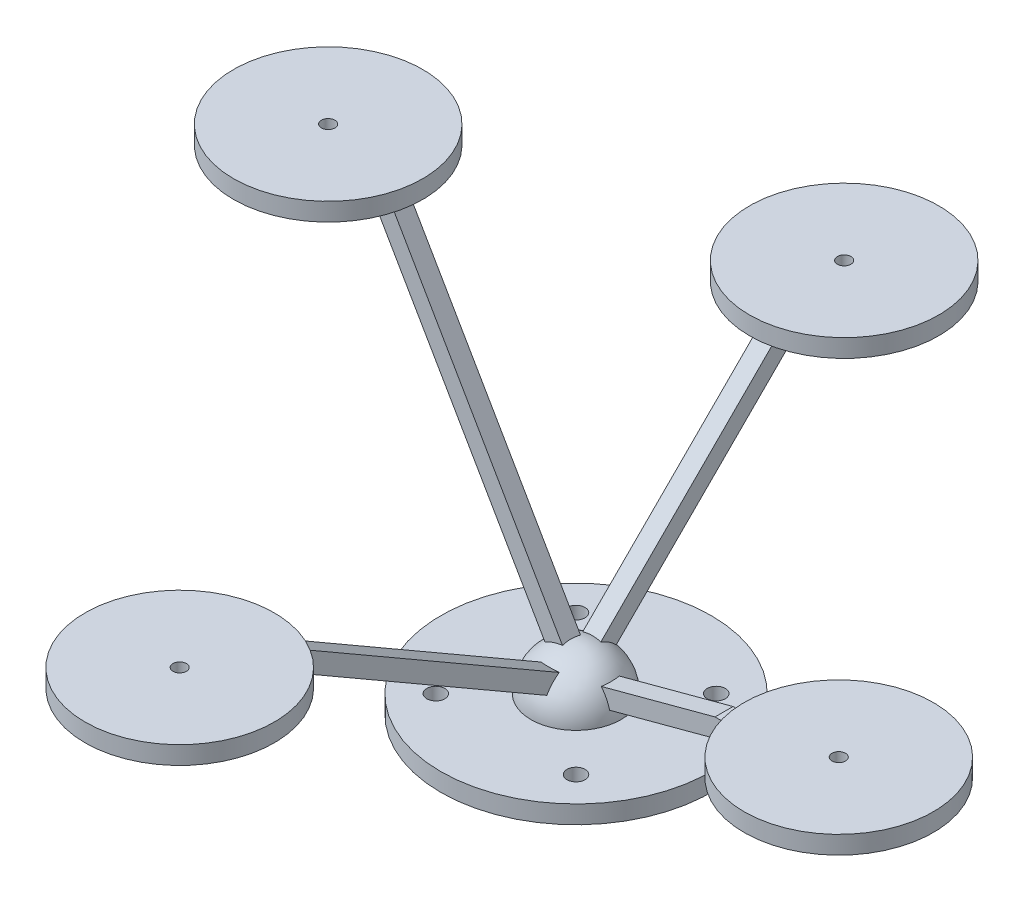
from build123d import *

# Parameters (mm, degrees)
SKETCH_1_R      = 15
SKETCH_1_R_2    = 1
EXTRUDE_1_DEPTH = 2
EXTRUDE_2_DEPTH = 1
SKETCH_4_R      = 10.5
SKETCH_4_R_2    = 0.75
EXTRUDE_3_DEPTH = 2
SKETCH_5_R      = 10.5
SKETCH_5_R_2    = 0.75
EXTRUDE_4_DEPTH = 2
EXTRUDE_5_DEPTH = 1
SKETCH_7_R      = 10.5
SKETCH_7_R_2    = 0.75
EXTRUDE_6_DEPTH = 2
SKETCH_8_R      = 10.5
SKETCH_8_R_2    = 0.75
EXTRUDE_7_DEPTH = 2


with BuildPart() as part:
    # 草图1 → 凸台-拉伸1 (new body)
    with BuildSketch(Plane(origin=(0, 0, 0), x_dir=(1, 0, 0), z_dir=(0, 1, 0))):
        with Locations(Location((0, 0, 0), (0, 0, 270))):
            Circle(SKETCH_1_R)
        with Locations(Location((7.778174593, 7.778174593, 0), (0, 0, 270))):
            Circle(SKETCH_1_R_2, mode=Mode.SUBTRACT)
        with Locations(Location((-7.778174593, 7.778174593, 0), (0, 0, 270))):
            Circle(SKETCH_1_R_2, mode=Mode.SUBTRACT)
        with Locations(Location((-7.778174593, -7.778174593, 0), (0, 0, 270))):
            Circle(SKETCH_1_R_2, mode=Mode.SUBTRACT)
        with Locations(Location((7.778174593, -7.778174593, 0), (0, 0, 270))):
            Circle(SKETCH_1_R_2, mode=Mode.SUBTRACT)
    extrude(amount=EXTRUDE_1_DEPTH)

    # 草图2 → 旋转1 (revolve)
    with BuildSketch(Plane(origin=(0, 0, 0), x_dir=(0, 0, -1), z_dir=(1, 0, 0))):
        with BuildLine():
            Line((0, 2), (0, 7))
            ThreePointArc((0, 7), (3.535533906, 5.535533906), (5, 2))
            Line((5, 2), (0, 2))
        make_face()
    revolve(axis=Axis((0, 2, 0), (0, 1, 0)))

    # 草图3 → 凸台-拉伸2 (add, symmetric)
    with BuildSketch(Plane.XY):
        Polygon((0, 2), (24.148145657, 8.470476128), (16.420739047, 8.470476128), (0, 4.070552361), (0, 6), (-20.190598923, 40.97114317), (-22.5, 40.97114317), align=None)
    extrude(amount=EXTRUDE_2_DEPTH, both=True)

    # 草图4 → 凸台-拉伸3 (add)
    with BuildSketch(Plane(origin=(0, 8.470476128, 0), x_dir=(1, 0, 0), z_dir=(0, 1, 0))):
        with Locations(Location((29.148145657, 0, 0), (0, 0, 174.5349762))):
            Circle(SKETCH_4_R)
        with Locations(Location((29.148145657, 0, 0), (0, 0, 270))):
            Circle(SKETCH_4_R_2, mode=Mode.SUBTRACT)
    extrude(amount=EXTRUDE_3_DEPTH)

    # 草图5 → 凸台-拉伸4 (add)
    with BuildSketch(Plane(origin=(0, 40.97114317, 0), x_dir=(1, 0, 0), z_dir=(0, 1, 0))):
        with Locations(Location((-27.5, 0, 0), (0, 0, 270))):
            Circle(SKETCH_5_R)
        with Locations(Location((-27.5, 0, 0), (0, 0, 270))):
            Circle(SKETCH_5_R_2, mode=Mode.SUBTRACT)
    extrude(amount=EXTRUDE_4_DEPTH)

    # 草图6 → 凸台-拉伸5 (add, symmetric)
    with BuildSketch(Plane(origin=(0, 0, 0), x_dir=(0, 0, -1), z_dir=(1, 0, 0))):
        Polygon((0, 2), (24.748737342, 26.748737342), (21.920310217, 26.748737342), (0, 4.828427125), (0, 4.309401077), (-34.97114317, 24.5), (-38.97114317, 24.5), align=None)
    extrude(amount=EXTRUDE_5_DEPTH, both=True)

    # 草图7 → 凸台-拉伸6 (add)
    with BuildSketch(Plane(origin=(0, 26.748737342, 0), x_dir=(1, 0, 0), z_dir=(0, 1, 0))):
        with Locations(Location((0, 29.748737342, 0), (0, 0, 270))):
            Circle(SKETCH_7_R)
        with Locations(Location((0, 29.748737342, 0), (0, 0, 270))):
            Circle(SKETCH_7_R_2, mode=Mode.SUBTRACT)
    extrude(amount=EXTRUDE_6_DEPTH)

    # 草图8 → 凸台-拉伸7 (add)
    with BuildSketch(Plane(origin=(0, 24.5, 0), x_dir=(1, 0, 0), z_dir=(0, 1, 0))):
        with Locations(Location((0, -43.97114317, 0), (0, 0, 270))):
            Circle(SKETCH_8_R)
        with Locations(Location((0, -43.97114317, 0), (0, 0, 270))):
            Circle(SKETCH_8_R_2, mode=Mode.SUBTRACT)
    extrude(amount=EXTRUDE_7_DEPTH)


solid = part.part
